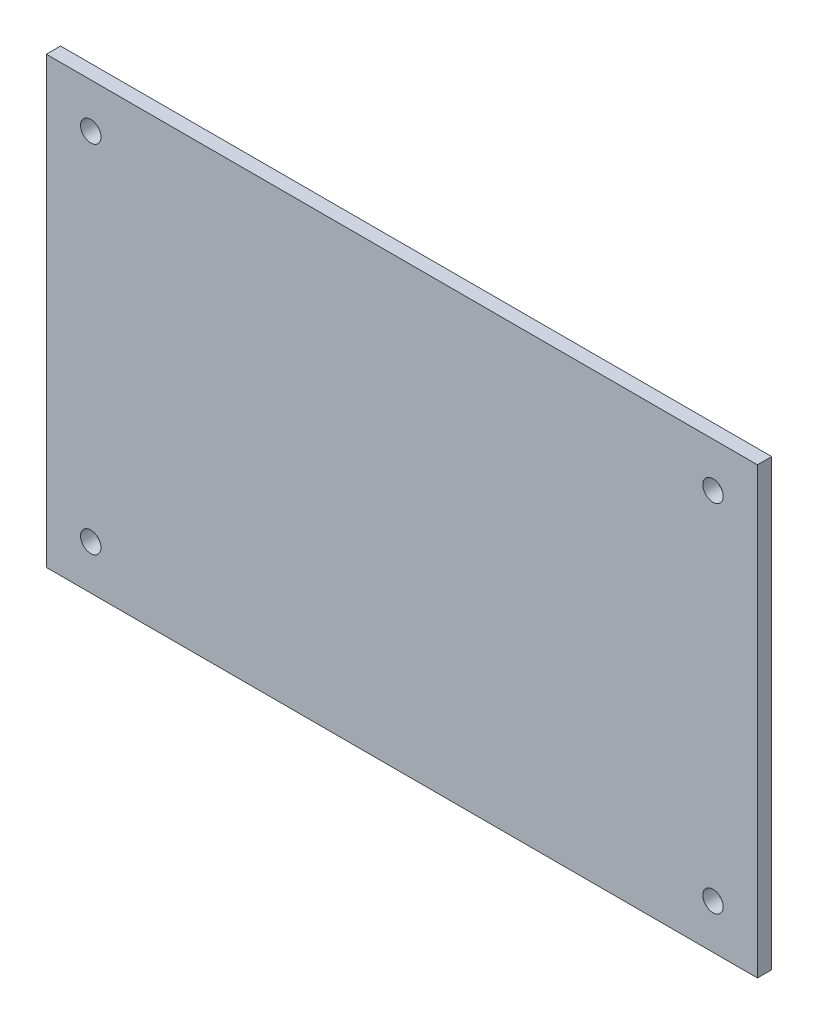
from build123d import *

# Parameters (mm, degrees)
SKETCH1_W           = 80
SKETCH1_H           = 50
SKETCH1_R           = 1.15
BOSS_EXTRUDE1_DEPTH = 1.6


with BuildPart() as part:
    # Sketch1 → Boss-Extrude1 (new body)
    with BuildSketch(Plane.XY):
        Rectangle(SKETCH1_W, SKETCH1_H)
        with Locations((-35, 20)):
            Circle(SKETCH1_R, mode=Mode.SUBTRACT)
        with Locations((-35, -20)):
            Circle(SKETCH1_R, mode=Mode.SUBTRACT)
        with Locations((35, 20)):
            Circle(SKETCH1_R, mode=Mode.SUBTRACT)
        with Locations((35, -20)):
            Circle(SKETCH1_R, mode=Mode.SUBTRACT)
    extrude(amount=BOSS_EXTRUDE1_DEPTH)


solid = part.part
